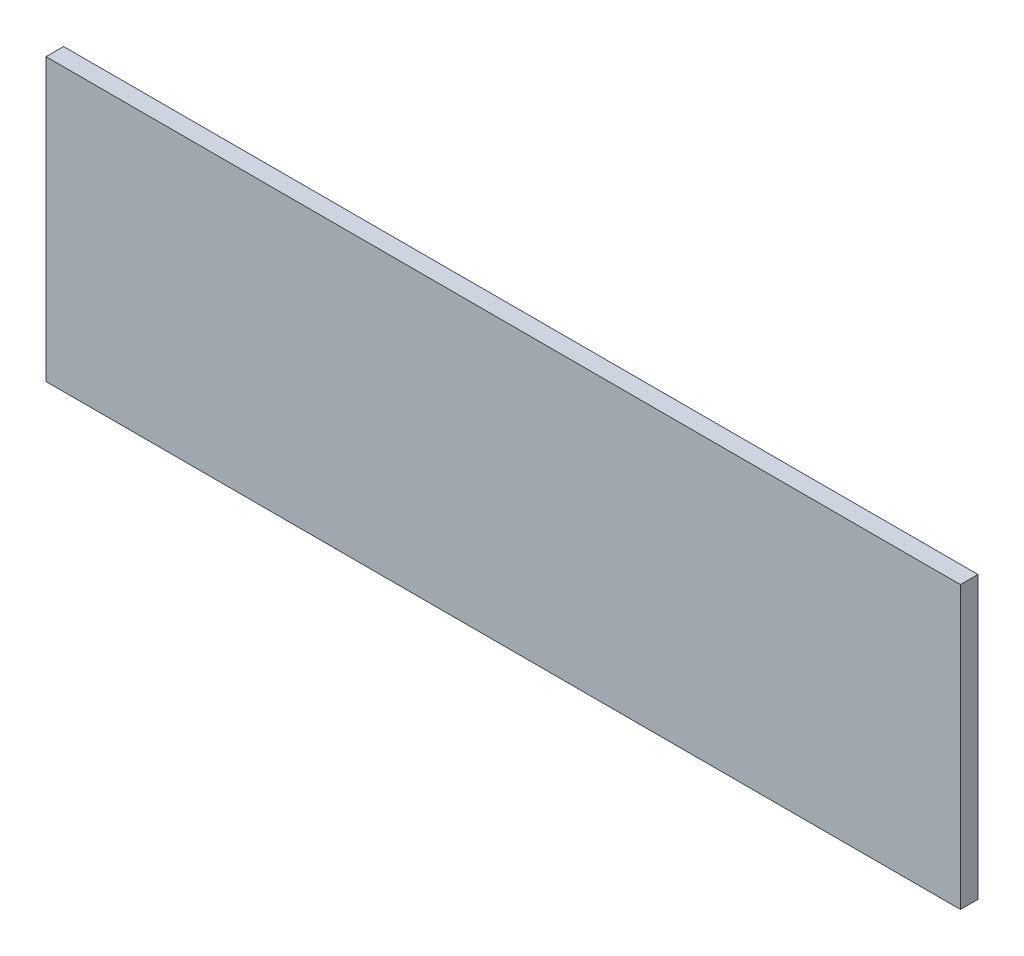
from build123d import *

# Parameters (mm, degrees)
SKETCH1_W           = 82.55
SKETCH1_H           = 25.4
BOSS_EXTRUDE1_DEPTH = 1.5875


with BuildPart() as part:
    # Sketch1 → Boss-Extrude1 (new body)
    with BuildSketch(Plane.XY):
        with Locations((41.275, 12.7)):
            Rectangle(SKETCH1_W, SKETCH1_H)
    extrude(amount=BOSS_EXTRUDE1_DEPTH)


solid = part.part
